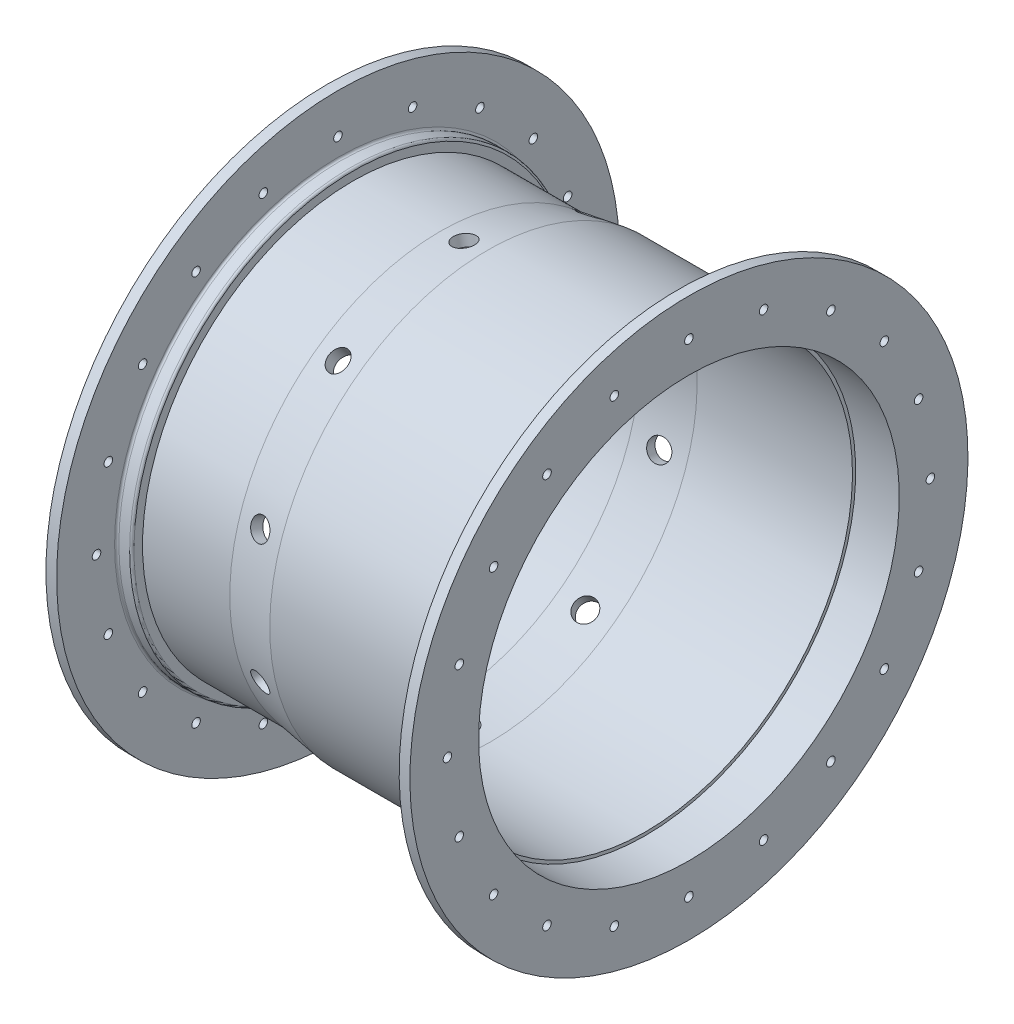
from build123d import *

# Parameters (mm, degrees)
CIRPATTERN1_COUNT  = 10
SKETCH3_R          = 2
CUT_EXTRUDE1_DEPTH = 251.512394039
CIRPATTERN2_COUNT  = 20
FILLET1_R          = 1


with BuildPart() as part:
    # Sketch1 → Revolve1 (revolve)
    with BuildSketch(Plane.XY, mode=Mode.PRIVATE) as revolve1_sk:
        Polygon((84.25, 130), (84.25, 98), (63.95, 98), (63.95, 96.5), (-8.441207607, 96.5), (-31.59, 92.908500421), (-67.825190796, 92.908500421), (-67.825190796, 86.908500421), (-77.238019118, 86.908500421), (-77.238019118, 98.080527858), (-84.25, 98.080527858), (-84.25, 131.080527858), (-79.25, 131.080527858), (-79.25, 103.080527858), (-72.238019118, 103.080527858), (-72.238019118, 98.080527858), (-31.59, 98.080527858), (-9.55, 101.5), (79.25, 101.5), (79.25, 130), align=None)
    revolve(revolve1_sk.sketch.rotate(Axis((-85.257963192, 0, 0), (1, 0, 0)), 180), axis=Axis((-85.257963192, 0, 0), (1, 0, 0)))

    # Sketch2 → Cut-Revolve1 (revolve, cut)
    with BuildSketch(Plane.XY, mode=Mode.PRIVATE) as cut_revolve1_sk:
        Polygon((-20.935268551, 101.861804822), (-25.859307316, 100.993563934), (-24.20280723, 91.599085112), (-19.278768465, 92.467326), align=None)
    cut_revolve1 = revolve(cut_revolve1_sk.sketch.rotate(Axis((-20.57, 99.790263929, 0), (-0.1736481776669314, 0.9848077530122079, 0)), 317.192577375), axis=Axis((-20.57, 99.790263929, 0), (-0.1736481776669314, 0.9848077530122079, 0)), mode=Mode.SUBTRACT)

    # CirPattern1: Cut-Revolve1 ×10 about axis
    cirpattern1_axis = Axis((-85.257963192, 0, 0), (-1, 0, 0))
    for i in range(1, CIRPATTERN1_COUNT):
        add(cut_revolve1.rotate(cirpattern1_axis, i * 360 / CIRPATTERN1_COUNT), mode=Mode.SUBTRACT)

    # Sketch3 → Cut-Extrude1 (cut, through all)
    with BuildSketch(Plane.ZY.offset(84.25)):
        with Locations(Location((0, 112.5, 0), (0, 0, 270))):
            Circle(SKETCH3_R)
    cut_extrude1 = extrude(amount=-CUT_EXTRUDE1_DEPTH, mode=Mode.SUBTRACT)

    # CirPattern2: Cut-Extrude1 ×20 about axis
    cirpattern2_axis = Axis((0, 0, 0), (1, 0, 0))
    for i in range(1, CIRPATTERN2_COUNT):
        add(cut_extrude1.rotate(cirpattern2_axis, i * 360 / CIRPATTERN2_COUNT), mode=Mode.SUBTRACT)

    # Fillet1
    fillet1_edges = [part.edges().sort_by_distance(p)[0] for p in [
        (79.25, 101.5, 0),
        (-72.238019118, 103.080527858, 0),
        (-79.25, 103.080527858, 0),
    ]]
    fillet(fillet1_edges, radius=FILLET1_R)


solid = part.part
